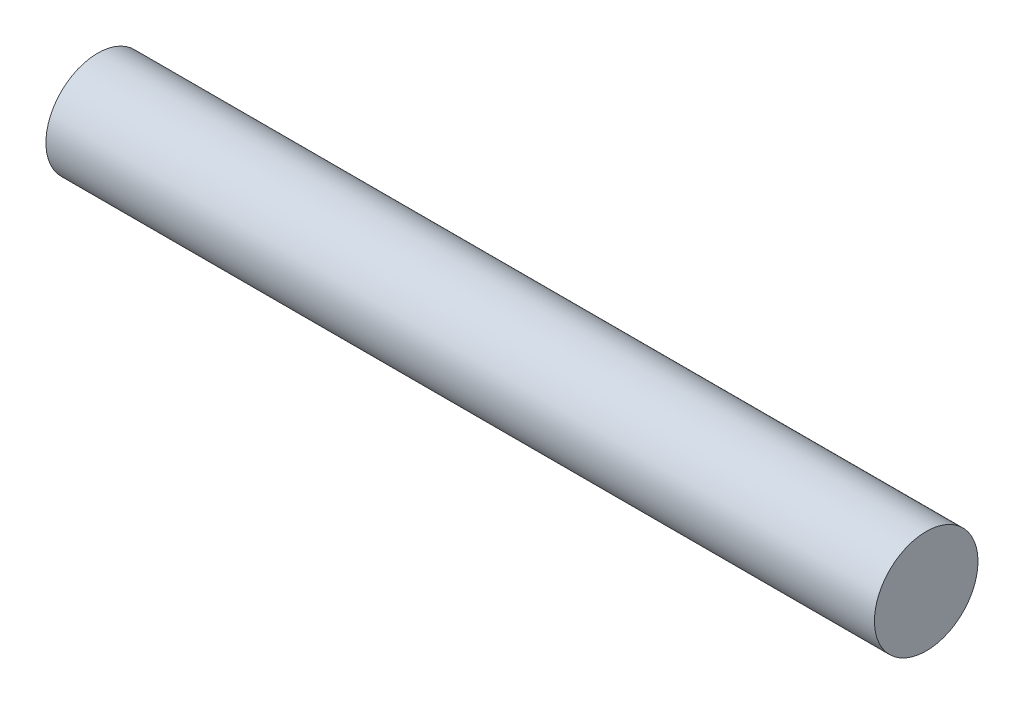
from build123d import *

# Parameters (mm, degrees)
SKETCH1_R           = 0.79375
BOSS_EXTRUDE1_DEPTH = 6.35


with BuildPart() as part:
    # Sketch1 → Boss-Extrude1 (new, symmetric)
    with BuildSketch(Plane(origin=(0, 0, 0), x_dir=(0, 0, -1), z_dir=(1, 0, 0))):
        Circle(SKETCH1_R)
    extrude(amount=BOSS_EXTRUDE1_DEPTH, both=True)


solid = part.part
